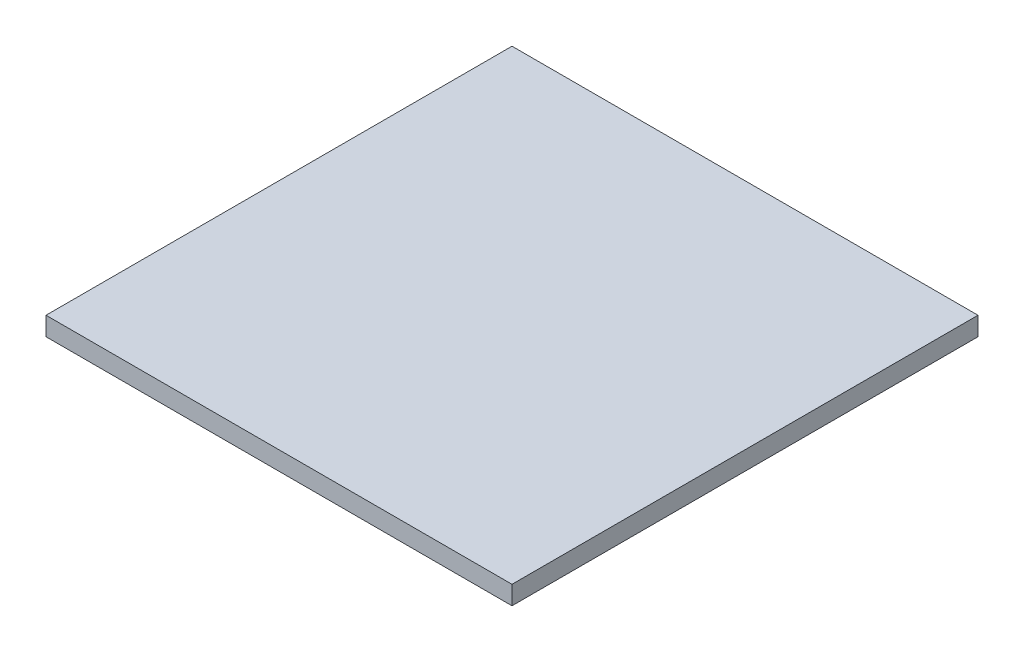
from build123d import *

# Parameters (mm, degrees)
SKETCH_1_W      = 200
SKETCH_1_H      = 200
EXTRUDE_1_DEPTH = 8


with BuildPart() as part:
    # 草图1 → 凸台-拉伸1 (new body)
    with BuildSketch(Plane(origin=(0, 0, 0), x_dir=(1, 0, 0), z_dir=(0, 1, 0))):
        with Locations((-100, 100)):
            Rectangle(SKETCH_1_W, SKETCH_1_H)
    extrude(amount=EXTRUDE_1_DEPTH)


solid = part.part
